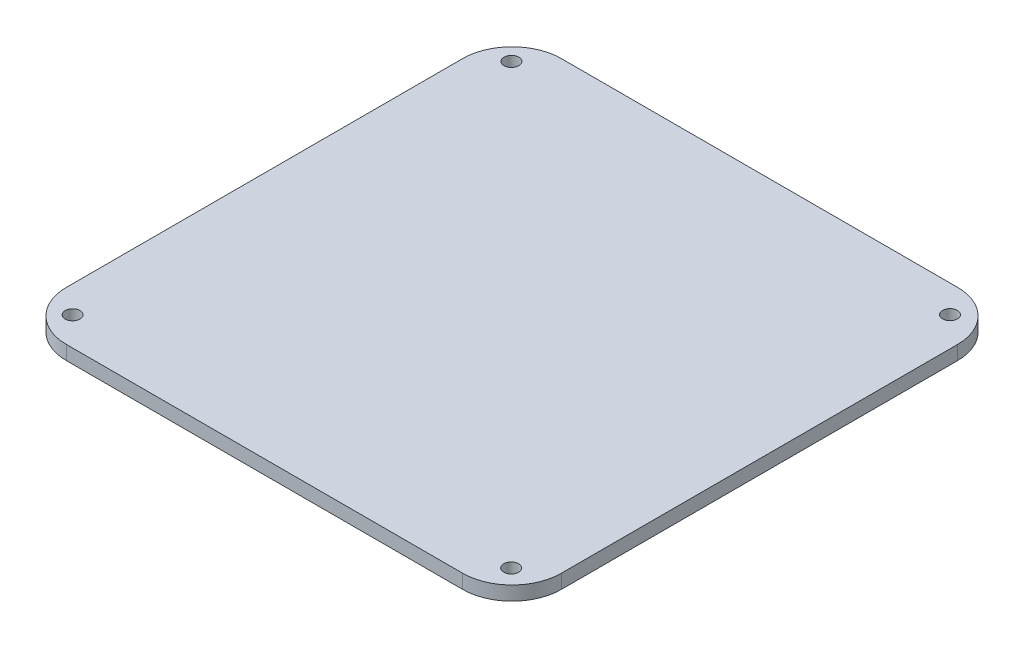
from build123d import *

# Parameters (mm, degrees)
SKETCH1_R           = 1.35
BOSS_EXTRUDE1_DEPTH = 2.56


with BuildPart() as part:
    # Sketch1 → Boss-Extrude1 (new body)
    with BuildSketch(Plane(origin=(0, 0, 0), x_dir=(1, 0, 0), z_dir=(0, 1, 0))):
        with BuildLine():
            Line((9, 0), (81.3, 0))
            ThreePointArc((81.3, 0), (87.663961031, 2.636038969), (90.3, 9))
            Line((90.3, 9), (90.3, 81.3))
            ThreePointArc((90.3, 81.3), (87.663961031, 87.663961031), (81.3, 90.3))
            Line((81.3, 90.3), (9, 90.3))
            ThreePointArc((9, 90.3), (2.636038969, 87.663961031), (0, 81.3))
            Line((0, 81.3), (0, 9))
            ThreePointArc((0, 9), (2.636038969, 2.636038969), (9, 0))
        make_face()
        with Locations(Location((4.9, 85.3, 0), (0, 0, 90))):
            Circle(SKETCH1_R, mode=Mode.SUBTRACT)
        with Locations(Location((84.9, 85.3, 0), (0, 0, 90))):
            Circle(SKETCH1_R, mode=Mode.SUBTRACT)
        with Locations(Location((84.9, 5.25, 0), (0, 0, 90))):
            Circle(SKETCH1_R, mode=Mode.SUBTRACT)
        with Locations(Location((4.9, 5.25, 0), (0, 0, 90))):
            Circle(SKETCH1_R, mode=Mode.SUBTRACT)
    extrude(amount=BOSS_EXTRUDE1_DEPTH)


solid = part.part
